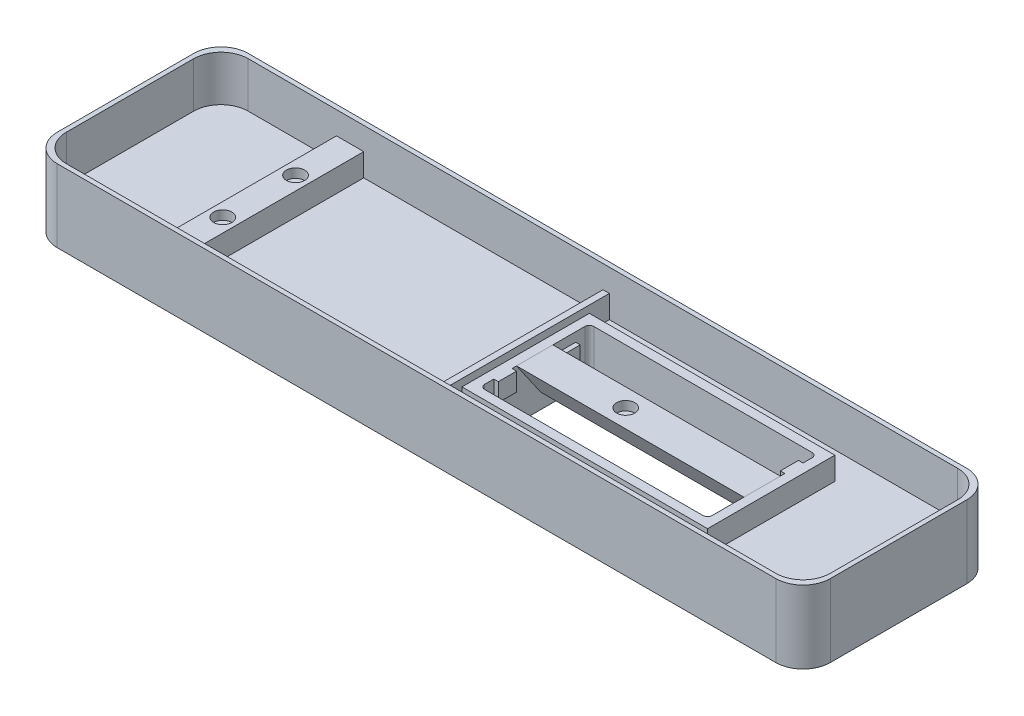
from build123d import *

# Parameters (mm, degrees)
SKETCH1_W               = 215.9
SKETCH1_H               = 53.34
BOSS_EXTRUDE1_DEPTH     = 10.16
SKETCH3_W               = 213.36
SKETCH3_H               = 50.8
CUT_EXTRUDE1_DEPTH      = 12.7
FILLET3_R               = 7.62
SKETCH4_W               = 7.62
SKETCH4_H               = 50.8
SKETCH4_W_2             = 1.778
BOSS_EXTRUDE2_DEPTH     = 6.35
SKETCH5_W               = 68.58
SKETCH5_H               = 35.56
BOSS_EXTRUDE3_DEPTH     = 6.35
CUT_EXTRUDE2_DEPTH      = 112.918637411
CUT_EXTRUDE2_DEPTH_BACK = 112.918637411
SKETCH9_W               = 63.5
SKETCH9_H               = 30.48
SKETCH10_W              = 63.5
SKETCH10_H              = 10.16
BOSS_EXTRUDE4_DEPTH     = 6.35
BOSS_EXTRUDE4_DRAFT     = -28
SKETCH11_W              = 5.08
SKETCH11_H              = 5.08
BOSS_EXTRUDE5_DEPTH     = 1.27
SKETCH13_W              = 5.08
SKETCH13_H              = 5.08
BOSS_EXTRUDE6_DEPTH     = 1.27
SKETCH16_W              = 10.16
SKETCH16_H              = 5.08
CUT_EXTRUDE3_DEPTH      = 1.27
FILLET4_R               = 1.27
SKETCH19_R              = 5.08
CUT_EXTRUDE5_DEPTH      = 0.508
SKETCH21_W              = 3.81
SKETCH21_H              = 0.381
CUT_EXTRUDE7_DEPTH      = 3.937
SKETCH24_R              = 2.54
CUT_EXTRUDE11_DEPTH     = 2.54
SKETCH25_R              = 2.54
CUT_EXTRUDE12_DEPTH     = 2.54


with BuildPart() as part:
    # Sketch1 → Boss-Extrude1 (new, symmetric)
    with BuildSketch(Plane(origin=(0, 0, 0), x_dir=(1, 0, 0), z_dir=(0, 1, 0))):
        Rectangle(SKETCH1_W, SKETCH1_H)
    extrude(amount=BOSS_EXTRUDE1_DEPTH, both=True)

    # Sketch3 → Cut-Extrude1 (cut)
    with BuildSketch(Plane(origin=(0, 10.16, 0), x_dir=(1, 0, 0), z_dir=(0, 1, 0))):
        Rectangle(SKETCH3_W, SKETCH3_H)
    extrude(amount=-CUT_EXTRUDE1_DEPTH, mode=Mode.SUBTRACT)

    # Fillet3
    fillet3_edges = [part.edges().sort_by_distance(p)[0] for p in [
        (106.68, 3.81, 25.4),
        (106.68, 3.81, -25.4),
        (-106.68, 3.81, 25.4),
        (-106.68, 3.81, -25.4),
        (-107.95, 0, 26.67),
        (107.95, 0, -26.67),
        (107.95, 0, 26.67),
        (-107.95, 0, -26.67),
    ]]
    fillet(fillet3_edges, radius=FILLET3_R)

    # Sketch4 → Boss-Extrude2 (add)
    with BuildSketch(Plane(origin=(0, -2.54, 0), x_dir=(1, 0, 0), z_dir=(0, 1, 0))):
        with Locations((-70.612, 0)):
            Rectangle(SKETCH4_W, SKETCH4_H)
        with Locations((0.889, 0)):
            Rectangle(SKETCH4_W_2, SKETCH4_H)
    extrude(amount=BOSS_EXTRUDE2_DEPTH)

    # Sketch5 → Boss-Extrude3 (add)
    with BuildSketch(Plane(origin=(0, -2.54, 0), x_dir=(1, 0, 0), z_dir=(0, 1, 0))):
        with Locations((38.1, 0)):
            Rectangle(SKETCH5_W, SKETCH5_H)
    extrude(amount=BOSS_EXTRUDE3_DEPTH)

    # Sketch9 → Cut-Extrude2 (cut, two sides: drawn at the far end of the back side and taken through both)
    with BuildSketch(Plane(origin=(0, -2.54, 0), x_dir=(1, 0, 0), z_dir=(0, 1, 0)).offset(-CUT_EXTRUDE2_DEPTH_BACK)):
        with Locations((38.1, 0)):
            Rectangle(SKETCH9_W, SKETCH9_H)
    extrude(amount=CUT_EXTRUDE2_DEPTH + CUT_EXTRUDE2_DEPTH_BACK, mode=Mode.SUBTRACT)

    # Sketch11 → Boss-Extrude5 (add)
    with BuildSketch(Plane(origin=(6.35, 0, 0), x_dir=(0, 0, -1), z_dir=(1, 0, 0))):
        with Locations((-8.89, 1.27)):
            Rectangle(SKETCH11_W, SKETCH11_H)
        with Locations((8.89, -1.27)):
            Rectangle(SKETCH11_W, SKETCH11_H)
    extrude(amount=BOSS_EXTRUDE5_DEPTH)

    # Sketch13 → Boss-Extrude6 (add)
    with BuildSketch(Plane.ZY.offset(-69.85)):
        with Locations((-8.89, 1.27)):
            Rectangle(SKETCH13_W, SKETCH13_H)
        with Locations((8.89, -1.27)):
            Rectangle(SKETCH13_W, SKETCH13_H)
    extrude(amount=BOSS_EXTRUDE6_DEPTH)

    # Sketch16 → Cut-Extrude3 (cut)
    with BuildSketch(Plane.ZY.offset(-69.85)):
        with Locations((0, -5.08)):
            Rectangle(SKETCH16_W, SKETCH16_H)
    extrude(amount=-CUT_EXTRUDE3_DEPTH, mode=Mode.SUBTRACT)

    # Fillet4
    fillet4_edges = [part.edges().sort_by_distance(p)[0] for p in [
        (69.85, -3.175, -15.24),
        (69.85, -3.175, 15.24),
        (6.35, -3.175, 15.24),
        (6.35, -3.175, -15.24),
    ]]
    fillet(fillet4_edges, radius=FILLET4_R)

    # Sketch19 → Cut-Extrude5 (cut)
    with BuildSketch(Plane.XZ.offset(10.16)):
        with Locations((71.12, 0)):
            Circle(SKETCH19_R)
    extrude(amount=-CUT_EXTRUDE5_DEPTH, mode=Mode.SUBTRACT)

    # Sketch21 → Cut-Extrude7 (cut)
    with BuildSketch(Plane(origin=(6.35, 0, 0), x_dir=(0, 0, -1), z_dir=(1, 0, 0))):
        with Locations((-10.795, -9.8425)):
            Rectangle(SKETCH21_W, SKETCH21_H)
        with Locations((10.795, -9.8425)):
            Rectangle(SKETCH21_W, SKETCH21_H)
    extrude(amount=-CUT_EXTRUDE7_DEPTH, mode=Mode.SUBTRACT)

    # Sketch24 → Cut-Extrude11 (cut)
    with BuildSketch(Plane(origin=(0, 3.81, 0), x_dir=(1, 0, 0), z_dir=(0, 1, 0))):
        with Locations((-70.612, -10.16)):
            Circle(SKETCH24_R)
        with Locations((-70.612, 10.16)):
            Circle(SKETCH24_R)
    extrude(amount=-CUT_EXTRUDE11_DEPTH, mode=Mode.SUBTRACT)


with BuildPart() as body_2:
    # Sketch10 → Boss-Extrude4 (with draft: the straight prism first)
    with BuildSketch(Plane(origin=(0, 3.81, 0), x_dir=(1, 0, 0), z_dir=(0, 1, 0))):
        with Locations((38.1, 0)):
            Rectangle(SKETCH10_W, SKETCH10_H)
    extrude(amount=-BOSS_EXTRUDE4_DEPTH)
    # Boss-Extrude4: the draft: its side faces are tilted about the plane it starts from
    boss_extrude4_sides = [body_2.faces().sort_by_distance(p)[0] for p in [
        (38.1, 0.635, 5.08),
        (69.85, 0.635, 0),
        (38.1, 0.635, -5.08),
        (6.35, 0.635, 0),
    ]]
    draft(boss_extrude4_sides, Plane(origin=(0, 3.81, 0), x_dir=(1, 0, 0), z_dir=(0, 1, 0)), BOSS_EXTRUDE4_DRAFT)

    # Sketch25 → Cut-Extrude12 (cut)
    with BuildSketch(Plane(origin=(0, 3.81, 0), x_dir=(1, 0, 0), z_dir=(0, 1, 0))):
        with Locations((31.75, 0)):
            Circle(SKETCH25_R)
    extrude(amount=-CUT_EXTRUDE12_DEPTH, mode=Mode.SUBTRACT)


solid = Compound([part.part, body_2.part])
